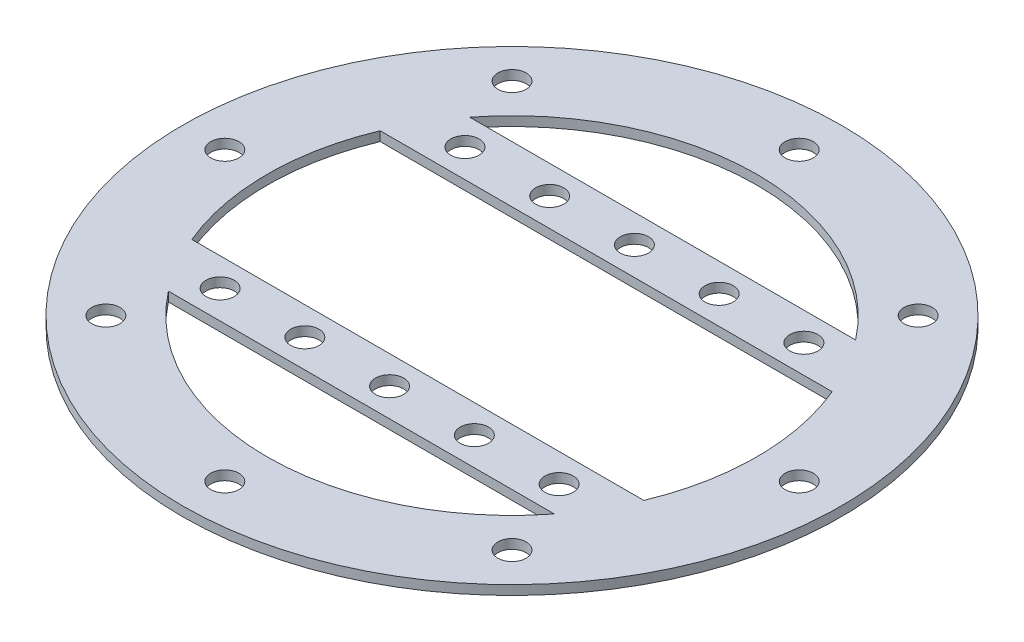
from build123d import *

# Parameters (mm, degrees)
SKETCH_1_R      = 35
SKETCH_1_R_2    = 1.5
EXTRUDE_1_DEPTH = 1


with BuildPart() as part:
    # Эскиз1 → Бобышка-Вытянуть1 (new body)
    with BuildSketch(Plane(origin=(0, 0, 0), x_dir=(1, 0, 0), z_dir=(0, 1, 0))):
        Circle(SKETCH_1_R)
        with BuildLine():
            Line((24, -10), (-18, -10))
            Line((-18, -10), (-24, -10))
            ThreePointArc((-24, -10), (-26, 0), (-24, 10))
            Line((-24, 10), (-18, 10))
            Line((-18, 10), (24, 10))
            ThreePointArc((24, 10), (26, 0), (24, -10))
        make_face(mode=Mode.SUBTRACT)
        with BuildLine():
            Line((-20.493901532, -16), (20.493901532, -16))
            ThreePointArc((20.493901532, -16), (0, -26), (-20.493901532, -16))
        make_face(mode=Mode.SUBTRACT)
        with Locations((-18, -13)):
            Circle(SKETCH_1_R_2, mode=Mode.SUBTRACT)
        with Locations((-9, -13)):
            Circle(SKETCH_1_R_2, mode=Mode.SUBTRACT)
        with Locations((0, -13)):
            Circle(SKETCH_1_R_2, mode=Mode.SUBTRACT)
        with Locations((9, -13)):
            Circle(SKETCH_1_R_2, mode=Mode.SUBTRACT)
        with Locations((18, -13)):
            Circle(SKETCH_1_R_2, mode=Mode.SUBTRACT)
        with Locations((-21.566756826, -21.566756826)):
            Circle(SKETCH_1_R_2, mode=Mode.SUBTRACT)
        with Locations((-30.5, 0)):
            Circle(SKETCH_1_R_2, mode=Mode.SUBTRACT)
        with Locations((0, -30.5)):
            Circle(SKETCH_1_R_2, mode=Mode.SUBTRACT)
        with Locations((21.566756826, -21.566756826)):
            Circle(SKETCH_1_R_2, mode=Mode.SUBTRACT)
        with Locations((-21.566756826, 21.566756826)):
            Circle(SKETCH_1_R_2, mode=Mode.SUBTRACT)
        with BuildLine():
            ThreePointArc((-20.493901532, 16), (0, 26), (20.493901532, 16))
            Line((20.493901532, 16), (-20.493901532, 16))
        make_face(mode=Mode.SUBTRACT)
        with Locations((0, 30.5)):
            Circle(SKETCH_1_R_2, mode=Mode.SUBTRACT)
        with Locations((21.566756826, 21.566756826)):
            Circle(SKETCH_1_R_2, mode=Mode.SUBTRACT)
        with Locations((30.5, 0)):
            Circle(SKETCH_1_R_2, mode=Mode.SUBTRACT)
        with Locations((18, 13)):
            Circle(SKETCH_1_R_2, mode=Mode.SUBTRACT)
        with Locations((-18, 13)):
            Circle(SKETCH_1_R_2, mode=Mode.SUBTRACT)
        with Locations((-9, 13)):
            Circle(SKETCH_1_R_2, mode=Mode.SUBTRACT)
        with Locations((0, 13)):
            Circle(SKETCH_1_R_2, mode=Mode.SUBTRACT)
        with Locations((9, 13)):
            Circle(SKETCH_1_R_2, mode=Mode.SUBTRACT)
    extrude(amount=EXTRUDE_1_DEPTH)


solid = part.part
